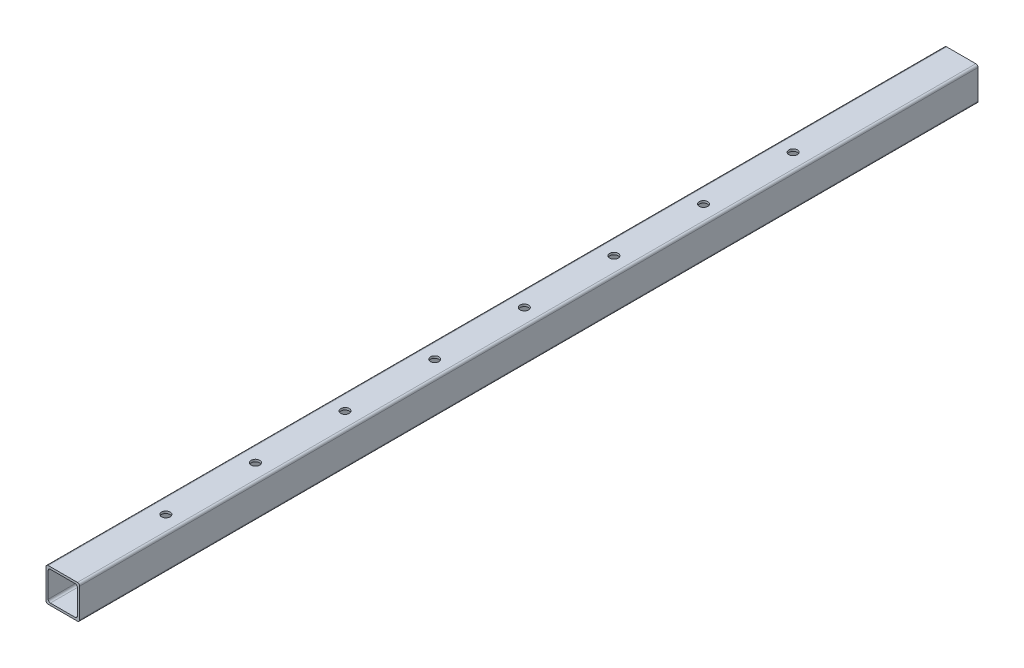
from build123d import *

# Parameters (mm, degrees)
SKETCH3_W           = 19.05
SKETCH3_H           = 19.05
SKETCH3_W_2         = 16.5608
SKETCH3_H_2         = 16.5608
BOSS_EXTRUDE1_DEPTH = 254.635
FILLET1_R           = 1.2446
CUT_EXTRUDE1_REACH  = 257.524
SKETCH4_R           = 2.413


with BuildPart() as part:
    # Sketch3 → Boss-Extrude1 (new, symmetric)
    with BuildSketch(Plane.XY):
        Rectangle(SKETCH3_W, SKETCH3_H)
        Rectangle(SKETCH3_W_2, SKETCH3_H_2, mode=Mode.SUBTRACT)
    extrude(amount=BOSS_EXTRUDE1_DEPTH, both=True)

    # Fillet1
    fillet1_edges = [part.edges().sort_by_distance(p)[0] for p in [
        (-9.525, 9.525, 0),
        (8.2804, -8.2804, 0),
        (-8.2804, -8.2804, 0),
        (-8.2804, 8.2804, 0),
        (8.2804, 8.2804, 0),
        (9.525, -9.525, 0),
        (-9.525, -9.525, 0),
        (9.525, 9.525, 0),
    ]]
    fillet(fillet1_edges, radius=FILLET1_R)

    # Sketch4 → Cut-Extrude1 (cut, up to next)
    with BuildSketch(Plane(origin=(0, 9.525, 0), x_dir=(1, 0, 0), z_dir=(0, 1, 0)), mode=Mode.PRIVATE) as cut_extrude1_sk1:
        with Locations((0, 159.385)):
            Circle(SKETCH4_R)
    cut_extrude1_tool1 = extrude(cut_extrude1_sk1.sketch, amount=-CUT_EXTRUDE1_REACH, mode=Mode.PRIVATE) & part.part
    # Sketch4 → Cut-Extrude1 (cut, up to next)
    with BuildSketch(Plane(origin=(0, 9.525, 0), x_dir=(1, 0, 0), z_dir=(0, 1, 0)), mode=Mode.PRIVATE) as cut_extrude1_sk2:
        with Locations((0, 108.585)):
            Circle(SKETCH4_R)
    cut_extrude1_tool2 = extrude(cut_extrude1_sk2.sketch, amount=-CUT_EXTRUDE1_REACH, mode=Mode.PRIVATE) & part.part
    # Sketch4 → Cut-Extrude1 (cut, up to next)
    with BuildSketch(Plane(origin=(0, 9.525, 0), x_dir=(1, 0, 0), z_dir=(0, 1, 0)), mode=Mode.PRIVATE) as cut_extrude1_sk3:
        with Locations((0, 57.785)):
            Circle(SKETCH4_R)
    cut_extrude1_tool3 = extrude(cut_extrude1_sk3.sketch, amount=-CUT_EXTRUDE1_REACH, mode=Mode.PRIVATE) & part.part
    # Sketch4 → Cut-Extrude1 (cut, up to next)
    with BuildSketch(Plane(origin=(0, 9.525, 0), x_dir=(1, 0, 0), z_dir=(0, 1, 0)), mode=Mode.PRIVATE) as cut_extrude1_sk4:
        with Locations((0, 6.985)):
            Circle(SKETCH4_R)
    cut_extrude1_tool4 = extrude(cut_extrude1_sk4.sketch, amount=-CUT_EXTRUDE1_REACH, mode=Mode.PRIVATE) & part.part
    # Sketch4 → Cut-Extrude1 (cut, up to next)
    with BuildSketch(Plane(origin=(0, 9.525, 0), x_dir=(1, 0, 0), z_dir=(0, 1, 0)), mode=Mode.PRIVATE) as cut_extrude1_sk5:
        with Locations((0, -43.815)):
            Circle(SKETCH4_R)
    cut_extrude1_tool5 = extrude(cut_extrude1_sk5.sketch, amount=-CUT_EXTRUDE1_REACH, mode=Mode.PRIVATE) & part.part
    # Sketch4 → Cut-Extrude1 (cut, up to next)
    with BuildSketch(Plane(origin=(0, 9.525, 0), x_dir=(1, 0, 0), z_dir=(0, 1, 0)), mode=Mode.PRIVATE) as cut_extrude1_sk6:
        with Locations((0, -94.615)):
            Circle(SKETCH4_R)
    cut_extrude1_tool6 = extrude(cut_extrude1_sk6.sketch, amount=-CUT_EXTRUDE1_REACH, mode=Mode.PRIVATE) & part.part
    # Sketch4 → Cut-Extrude1 (cut, up to next)
    with BuildSketch(Plane(origin=(0, 9.525, 0), x_dir=(1, 0, 0), z_dir=(0, 1, 0)), mode=Mode.PRIVATE) as cut_extrude1_sk7:
        with Locations((0, -145.415)):
            Circle(SKETCH4_R)
    cut_extrude1_tool7 = extrude(cut_extrude1_sk7.sketch, amount=-CUT_EXTRUDE1_REACH, mode=Mode.PRIVATE) & part.part
    # Sketch4 → Cut-Extrude1 (cut, up to next)
    with BuildSketch(Plane(origin=(0, 9.525, 0), x_dir=(1, 0, 0), z_dir=(0, 1, 0)), mode=Mode.PRIVATE) as cut_extrude1_sk8:
        with Locations((0, -196.215)):
            Circle(SKETCH4_R)
    cut_extrude1_tool8 = extrude(cut_extrude1_sk8.sketch, amount=-CUT_EXTRUDE1_REACH, mode=Mode.PRIVATE) & part.part
    add(cut_extrude1_tool1.solids().sort_by_distance((0, 9.525, -159.385))[0], mode=Mode.SUBTRACT)
    add(cut_extrude1_tool2.solids().sort_by_distance((0, 9.525, -108.585))[0], mode=Mode.SUBTRACT)
    add(cut_extrude1_tool3.solids().sort_by_distance((0, 9.525, -57.785))[0], mode=Mode.SUBTRACT)
    add(cut_extrude1_tool4.solids().sort_by_distance((0, 9.525, -6.985))[0], mode=Mode.SUBTRACT)
    add(cut_extrude1_tool5.solids().sort_by_distance((0, 9.525, 43.815))[0], mode=Mode.SUBTRACT)
    add(cut_extrude1_tool6.solids().sort_by_distance((0, 9.525, 94.615))[0], mode=Mode.SUBTRACT)
    add(cut_extrude1_tool7.solids().sort_by_distance((0, 9.525, 145.415))[0], mode=Mode.SUBTRACT)
    add(cut_extrude1_tool8.solids().sort_by_distance((0, 9.525, 196.215))[0], mode=Mode.SUBTRACT)


solid = part.part
